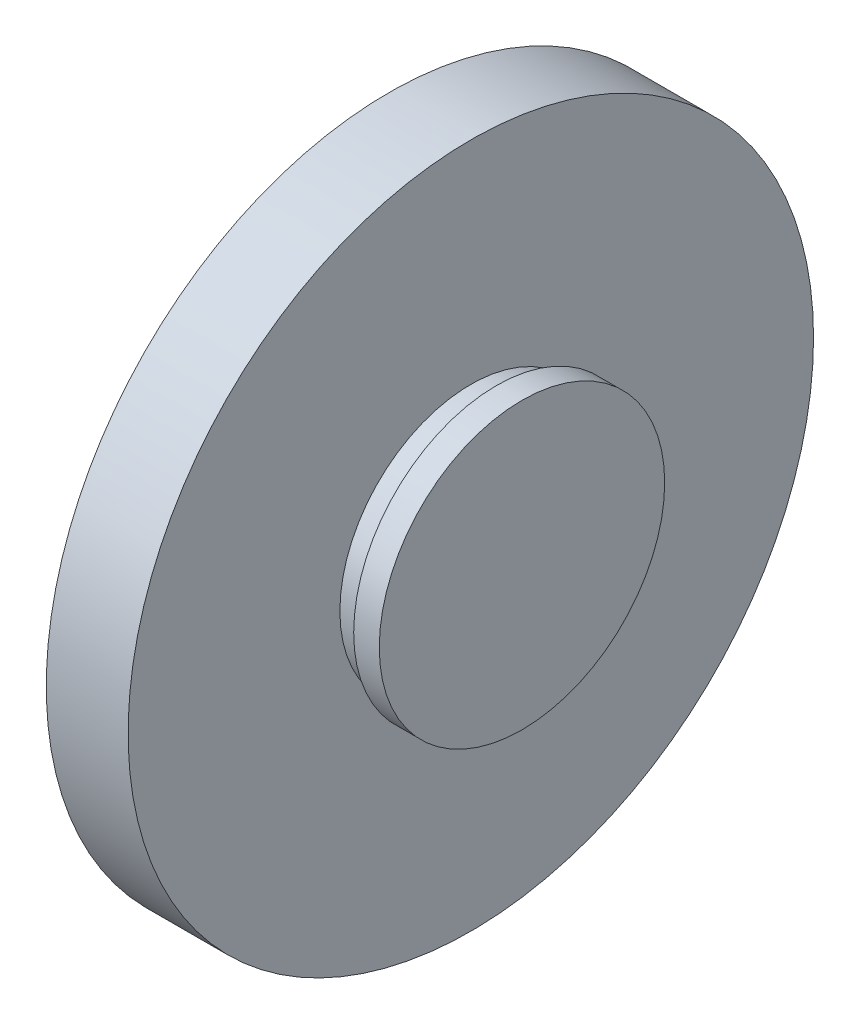
from build123d import *

# Parameters (mm, degrees)
SKETCH2_R           = 33.5
BOSS_EXTRUDE1_DEPTH = 8
SKETCH7_R           = 12.8
BOSS_EXTRUDE2_DEPTH = 2.5
SKETCH8_R           = 13.95
BOSS_EXTRUDE3_DEPTH = 2.5
CUT_EXTRUDE1_DEPTH  = 5.5
SKETCH11_R          = 6
CUT_EXTRUDE2_DEPTH  = 3.2


with BuildPart() as part:
    # Sketch2 → Boss-Extrude1 (new body)
    with BuildSketch(Plane(origin=(0, 0, 0), x_dir=(0, 0, -1), z_dir=(1, 0, 0))):
        Circle(SKETCH2_R)
    extrude(amount=BOSS_EXTRUDE1_DEPTH)

    # Sketch7 → Boss-Extrude2 (add)
    with BuildSketch(Plane(origin=(8, 0, 0), x_dir=(0, 0, -1), z_dir=(1, 0, 0))):
        Circle(SKETCH7_R)
    extrude(amount=BOSS_EXTRUDE2_DEPTH)

    # Sketch8 → Boss-Extrude3 (add)
    with BuildSketch(Plane(origin=(10.5, 0, 0), x_dir=(0, 0, -1), z_dir=(1, 0, 0))):
        Circle(SKETCH8_R)
    extrude(amount=BOSS_EXTRUDE3_DEPTH)

    # Sketch10 → Cut-Extrude1 (cut)
    with BuildSketch(Plane.ZY):
        with BuildLine():
            Line((-4, -27.203944189), (-6.5, -6.5))
            Line((-6.5, -6.5), (-27.203944189, -4))
            ThreePointArc((-27.203944189, -4), (-30.75, 0), (-27.203944189, 4))
            Line((-27.203944189, 4), (-6.5, 6.5))
            Line((-6.5, 6.5), (-4, 27.203944189))
            ThreePointArc((-4, 27.203944189), (0, 30.75), (4, 27.203944189))
            Line((4, 27.203944189), (6.5, 6.5))
            Line((6.5, 6.5), (27.203944189, 4))
            ThreePointArc((27.203944189, 4), (30.75, 0), (27.203944189, -4))
            Line((27.203944189, -4), (6.5, -6.5))
            Line((6.5, -6.5), (4, -27.203944189))
            ThreePointArc((4, -27.203944189), (0, -30.75), (-4, -27.203944189))
        make_face()
    extrude(amount=-CUT_EXTRUDE1_DEPTH, mode=Mode.SUBTRACT)

    # Sketch11 → Cut-Extrude2 (cut)
    with BuildSketch(Plane.ZY.offset(-5.5)):
        Circle(SKETCH11_R)
    extrude(amount=-CUT_EXTRUDE2_DEPTH, mode=Mode.SUBTRACT)


solid = part.part
